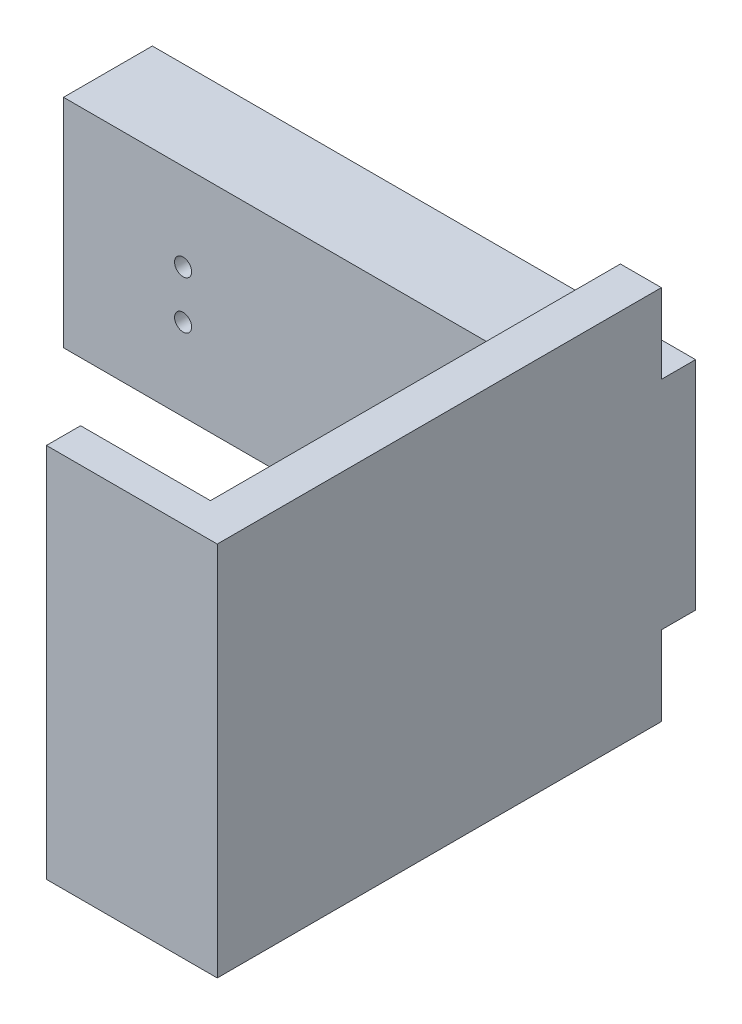
from build123d import *

# Parameters (mm, degrees)
SKETCH1_W           = 50
SKETCH1_H           = 110
BOSS_EXTRUDE1_DEPTH = 10
SKETCH2_W           = 12
SKETCH2_H           = 110
BOSS_EXTRUDE2_DEPTH = 120
BOSS_EXTRUDE4_DEPTH = 152
BOSS_EXTRUDE5_DEPTH = 10
SKETCH5_W           = 152
SKETCH5_H           = 8
BOSS_EXTRUDE6_DEPTH = 10
SKETCH6_W           = 152
SKETCH6_H           = 8
BOSS_EXTRUDE7_DEPTH = 10
SKETCH7_R           = 2.5
CUT_EXTRUDE1_DEPTH  = 87
SKETCH8_W           = 26
SKETCH8_H           = 63.5
CUT_EXTRUDE2_DEPTH  = 5


with BuildPart() as part:
    # Sketch1 → Boss-Extrude1 (new body)
    with BuildSketch(Plane.XY):
        with Locations((-25, 55)):
            Rectangle(SKETCH1_W, SKETCH1_H)
    extrude(amount=BOSS_EXTRUDE1_DEPTH)

    # Sketch2 → Boss-Extrude2 (add)
    with BuildSketch(Plane(origin=(0, 0, 0), x_dir=(-1, 0, 0), z_dir=(0, 0, -1))):
        with Locations((6, 55)):
            Rectangle(SKETCH2_W, SKETCH2_H)
    extrude(amount=BOSS_EXTRUDE2_DEPTH)

    # Sketch3 → Boss-Extrude4 (add)
    with BuildSketch(Plane.ZY.offset(12)):
        Polygon((-120, 86.75), (-120, 76.75), (-114, 76.75), (-114, 33.25), (-120, 33.25), (-120, 23.25), (-104, 23.25), (-104, 86.75), align=None)
    extrude(amount=BOSS_EXTRUDE4_DEPTH)

    # Sketch4 → Boss-Extrude5 (add)
    with BuildSketch(Plane(origin=(0, 0, -120), x_dir=(-1, 0, 0), z_dir=(0, 0, -1))):
        Polygon((12, 86.75), (0, 86.75), (0, 23.25), (12, 23.25), (164, 23.25), (164, 33.25), (12, 33.25), (12, 76.75), (164, 76.75), (164, 86.75), align=None)
    extrude(amount=BOSS_EXTRUDE5_DEPTH)

    # Sketch5 → Boss-Extrude6 (add)
    with BuildSketch(Plane.XZ.offset(-76.75)):
        with Locations((-88, -126)):
            Rectangle(SKETCH5_W, SKETCH5_H)
    extrude(amount=BOSS_EXTRUDE6_DEPTH)

    # Sketch6 → Boss-Extrude7 (add)
    with BuildSketch(Plane(origin=(0, 33.25, 0), x_dir=(1, 0, 0), z_dir=(0, 1, 0))):
        with Locations((-88, 126)):
            Rectangle(SKETCH6_W, SKETCH6_H)
    extrude(amount=BOSS_EXTRUDE7_DEPTH)

    # Sketch7 → Cut-Extrude1 (cut)
    with BuildSketch(Plane.XY.offset(-104)):
        with Locations((-124, 61.25)):
            Circle(SKETCH7_R)
        with Locations((-124, 47.25)):
            Circle(SKETCH7_R)
    extrude(amount=-CUT_EXTRUDE1_DEPTH, mode=Mode.SUBTRACT)

    # Sketch8 → Cut-Extrude2 (cut)
    with BuildSketch(Plane.ZY.offset(164)):
        with Locations((-117, 55)):
            Rectangle(SKETCH8_W, SKETCH8_H)
    extrude(amount=-CUT_EXTRUDE2_DEPTH, mode=Mode.SUBTRACT)


solid = part.part
